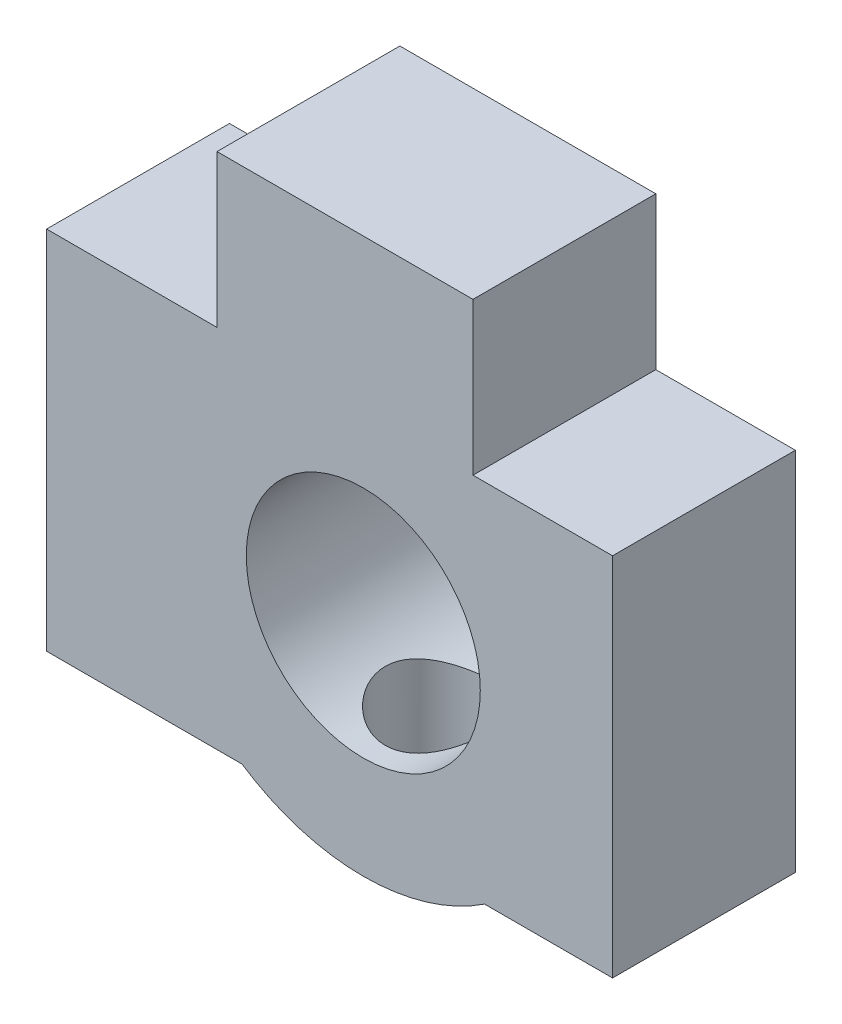
from build123d import *

# Parameters (mm, degrees)
SKETCH_1_R               = 3.2
EXTRUDE_1_DEPTH          = 5
CUT_EXTRUDE_1_DEPTH      = 5
CUT_EXTRUDE_1_DEPTH_BACK = 5
SKETCH_2_R               = 1.5


with BuildPart() as part:
    # 草图1 → 凸台-拉伸1 (new body)
    with BuildSketch(Plane.XY):
        with BuildLine():
            Line((-3.31662479, -5), (-8.660254038, -5))
            Line((-8.660254038, -5), (-8.660254038, 5))
            Line((-8.660254038, 5), (-4, 5))
            Line((-4, 5), (-4, 9.16515139))
            Line((-4, 9.16515139), (3, 9.16515139))
            Line((3, 9.16515139), (3, 5))
            Line((3, 5), (6.81662479, 5))
            Line((6.81662479, 5), (6.81662479, -5))
            Line((6.81662479, -5), (3.31662479, -5))
            ThreePointArc((3.31662479, -5), (0, -6), (-3.31662479, -5))
        make_face()
        Circle(SKETCH_1_R, mode=Mode.SUBTRACT)
    extrude(amount=EXTRUDE_1_DEPTH)

    # 草图2 → 切除-拉伸1 (cut, two sides: drawn at the far end of the back side and taken through both)
    with BuildSketch(Plane.XZ.offset(5).offset(-CUT_EXTRUDE_1_DEPTH_BACK)):
        with Locations((0, 2.9)):
            Circle(SKETCH_2_R)
    extrude(amount=CUT_EXTRUDE_1_DEPTH + CUT_EXTRUDE_1_DEPTH_BACK, mode=Mode.SUBTRACT)


solid = part.part
